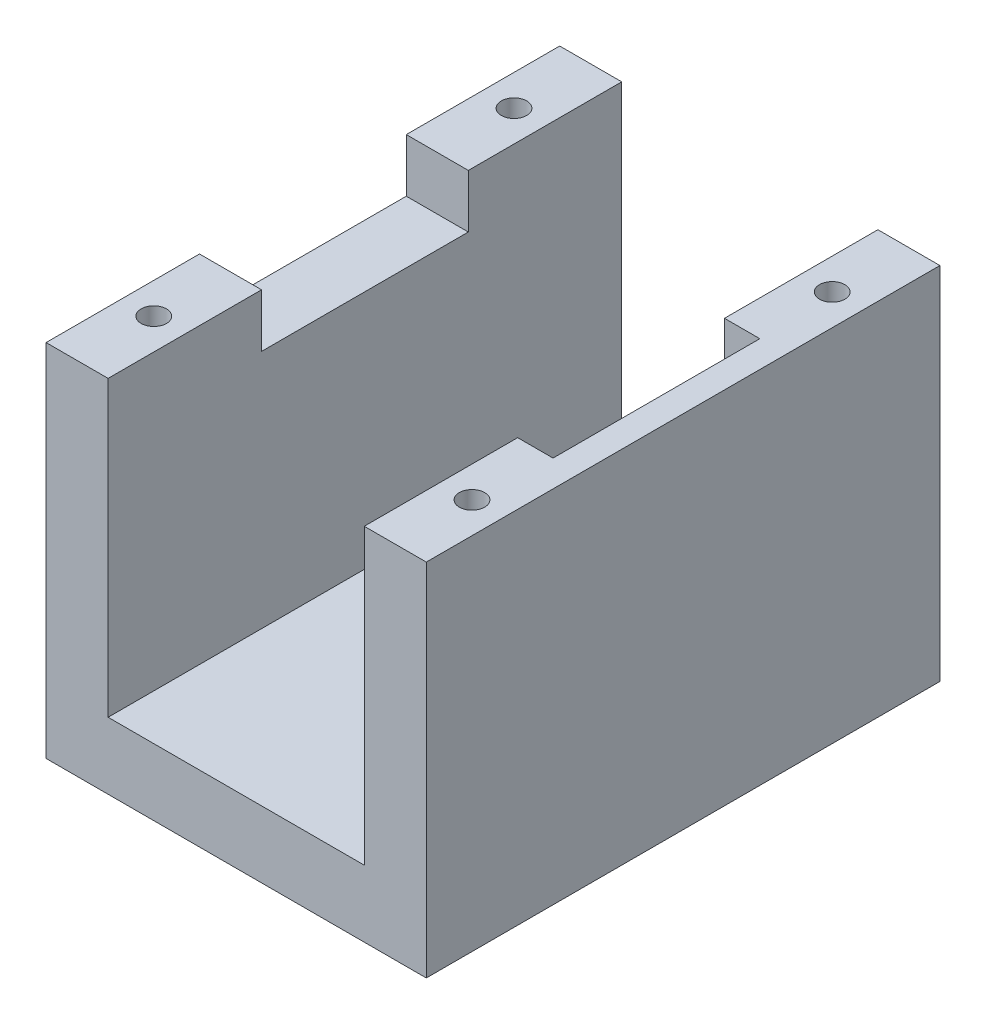
from build123d import *

# Parameters (mm, degrees)
SKETCH1_W           = 57
SKETCH1_H           = 37
BOSS_EXTRUDE1_DEPTH = 44
SKETCH2_W           = 38.4
SKETCH2_H           = 36
CUT_EXTRUDE1_DEPTH  = 47
BOSS_EXTRUDE2_DEPTH = 20
BOSS_EXTRUDE3_DEPTH = 20
SKETCH7_W           = 53
SKETCH7_H           = 31
CUT_EXTRUDE4_DEPTH  = 8
SKETCH8_R           = 1.9
CUT_EXTRUDE5_DEPTH  = 40
SKETCH10_W          = 57
SKETCH10_H          = 77
BOSS_EXTRUDE4_DEPTH = 10
SKETCH12_W          = 38.4
SKETCH12_H          = 77
CUT_EXTRUDE6_DEPTH  = 8


with BuildPart() as part:
    # Sketch1 → Boss-Extrude1 (new body)
    with BuildSketch(Plane(origin=(0, 0, 0), x_dir=(1, 0, 0), z_dir=(0, 1, 0))):
        Rectangle(SKETCH1_W, SKETCH1_H)
    extrude(amount=BOSS_EXTRUDE1_DEPTH)

    # Sketch2 → Cut-Extrude1 (cut)
    with BuildSketch(Plane.XY.offset(18.5)):
        with Locations((0, 18)):
            Rectangle(SKETCH2_W, SKETCH2_H)
    extrude(amount=-CUT_EXTRUDE1_DEPTH, mode=Mode.SUBTRACT)

    # Sketch5 → Boss-Extrude2 (add)
    with BuildSketch(Plane(origin=(0, 0, -18.5), x_dir=(-1, 0, 0), z_dir=(0, 0, -1))):
        Polygon((-19.2, 36), (19.2, 36), (19.2, 0), (28.5, 0), (28.5, 44), (-28.5, 44), (-28.5, 0), (-19.2, 0), align=None)
    extrude(amount=BOSS_EXTRUDE2_DEPTH)

    # Sketch6 → Boss-Extrude3 (add)
    with BuildSketch(Plane.XY.offset(18.5)):
        Polygon((-28.5, 0), (-19.2, 0), (-19.2, 36), (19.2, 36), (19.2, 0), (28.5, 0), (28.5, 44), (-28.5, 44), align=None)
    extrude(amount=BOSS_EXTRUDE3_DEPTH)

    # Sketch7 → Cut-Extrude4 (cut)
    with BuildSketch(Plane(origin=(0, 44, 0), x_dir=(1, 0, 0), z_dir=(0, 1, 0))):
        with Locations((-2, 0)):
            Rectangle(SKETCH7_W, SKETCH7_H)
    extrude(amount=-CUT_EXTRUDE4_DEPTH, mode=Mode.SUBTRACT)

    # Sketch8 → Cut-Extrude5 (cut)
    with BuildSketch(Plane(origin=(0, 44, 0), x_dir=(1, 0, 0), z_dir=(0, 1, 0))):
        with Locations((-23.85, 27)):
            Circle(SKETCH8_R)
        with Locations((23.85, 27)):
            Circle(SKETCH8_R)
        with Locations((-23.85, -27)):
            Circle(SKETCH8_R)
        with Locations((23.85, -27)):
            Circle(SKETCH8_R)
    extrude(amount=-CUT_EXTRUDE5_DEPTH, mode=Mode.SUBTRACT)

    # Sketch10 → Boss-Extrude4 (add)
    with BuildSketch(Plane.XZ):
        Rectangle(SKETCH10_W, SKETCH10_H)
    extrude(amount=BOSS_EXTRUDE4_DEPTH)

    # Sketch12 → Cut-Extrude6 (cut)
    with BuildSketch(Plane(origin=(0, 44, 0), x_dir=(1, 0, 0), z_dir=(0, 1, 0))):
        Rectangle(SKETCH12_W, SKETCH12_H)
    extrude(amount=-CUT_EXTRUDE6_DEPTH, mode=Mode.SUBTRACT)


solid = part.part
